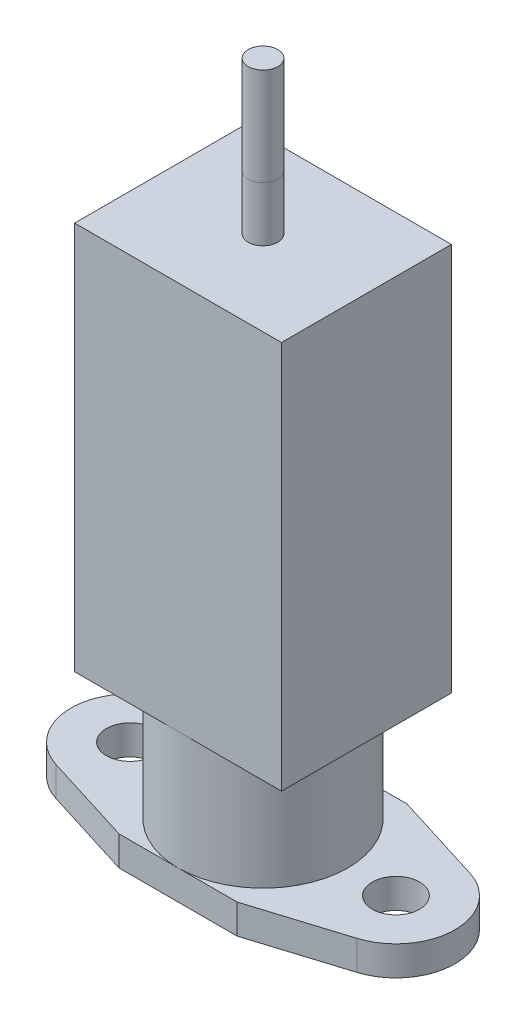
from build123d import *

# Parameters (mm, degrees)
SKETCH1_R           = 1.6
BOSS_EXTRUDE1_DEPTH = 2
SKETCH2_R           = 5.75
BOSS_EXTRUDE2_DEPTH = 8
SKETCH3_W           = 14
SKETCH3_H           = 11.5
BOSS_EXTRUDE3_DEPTH = 26.3
SKETCH4_R           = 1
BOSS_EXTRUDE4_DEPTH = 3.7
BOSS_EXTRUDE5_START = 3.7
SKETCH4_2_R         = 1
BOSS_EXTRUDE5_DEPTH = 6.6


with BuildPart() as part:
    # Sketch1 → Boss-Extrude1 (new body)
    # profile 1 of 3: a face of its own
    with BuildSketch(Plane(origin=(0, 0, 0), x_dir=(1, 0, 0), z_dir=(0, 1, 0))):
        with BuildLine():
            Line((-9, -4), (9, -4))
            ThreePointArc((9, -4), (13, 0), (9, 4))
            Line((9, 4), (-9, 4))
            ThreePointArc((-9, 4), (-13, 0), (-9, -4))
        make_face()
        with Locations(Location((-9, 0, 0), (0, 0, 270))):
            Circle(SKETCH1_R, mode=Mode.SUBTRACT)
        with Locations(Location((9, 0, 0), (0, 0, 270))):
            Circle(SKETCH1_R, mode=Mode.SUBTRACT)
    # profile 2 of 3: a face of its own
    with BuildSketch(Plane(origin=(0, 0, 0), x_dir=(1, 0, 0), z_dir=(0, 1, 0))):
        with BuildLine():
            ThreePointArc((-10.191266314, 3.818492447), (-9.602507349, 3.954362767), (-9, 4))
            Line((-9, 4), (9, 4))
            ThreePointArc((9, 4), (9.602507349, 3.954362767), (10.191266314, 3.818492447))
            Line((10.191266314, 3.818492447), (4, 5.75))
            Line((4, 5.75), (-4, 5.75))
            Line((-4, 5.75), (-10.191266314, 3.818492447))
        make_face()
    # profile 3 of 3: a face of its own
    with BuildSketch(Plane(origin=(0, 0, 0), x_dir=(1, 0, 0), z_dir=(0, 1, 0))):
        with BuildLine():
            ThreePointArc((-9, -4), (-9.602507349, -3.954362767), (-10.191266314, -3.818492447))
            Line((-10.191266314, -3.818492447), (-4, -5.75))
            Line((-4, -5.75), (4, -5.75))
            Line((4, -5.75), (10.191266314, -3.818492447))
            ThreePointArc((10.191266314, -3.818492447), (9.602507349, -3.954362767), (9, -4))
            Line((9, -4), (-9, -4))
        make_face()
    extrude(amount=BOSS_EXTRUDE1_DEPTH)

    # Sketch2 → Boss-Extrude2 (add)
    with BuildSketch(Plane(origin=(0, 2, 0), x_dir=(1, 0, 0), z_dir=(0, 1, 0))):
        with Locations(Location((0, 0, 0), (0, 0, 270))):
            Circle(SKETCH2_R)
    extrude(amount=BOSS_EXTRUDE2_DEPTH)

    # Sketch3 → Boss-Extrude3 (add)
    with BuildSketch(Plane(origin=(0, 10, 0), x_dir=(1, 0, 0), z_dir=(0, 1, 0))):
        Rectangle(SKETCH3_W, SKETCH3_H)
    extrude(amount=BOSS_EXTRUDE3_DEPTH)

    # Sketch4 → Boss-Extrude4 (add)
    with BuildSketch(Plane(origin=(0, 36.3, 0), x_dir=(1, 0, 0), z_dir=(0, 1, 0))):
        with Locations(Location((0, 0, 0), (0, 0, 270))):
            Circle(SKETCH4_R)
    extrude(amount=BOSS_EXTRUDE4_DEPTH)


with BuildPart() as body_2:
    # Sketch4<2> → Boss-Extrude5 (new body)
    with BuildSketch(Plane(origin=(0, 36.3, 0), x_dir=(1, 0, 0), z_dir=(0, 1, 0)).offset(BOSS_EXTRUDE5_START)):
        with Locations(Location((0, 0, 0), (0, 0, 270))):
            Circle(SKETCH4_2_R)
    extrude(amount=BOSS_EXTRUDE5_DEPTH)


solid = Compound([part.part, body_2.part])
